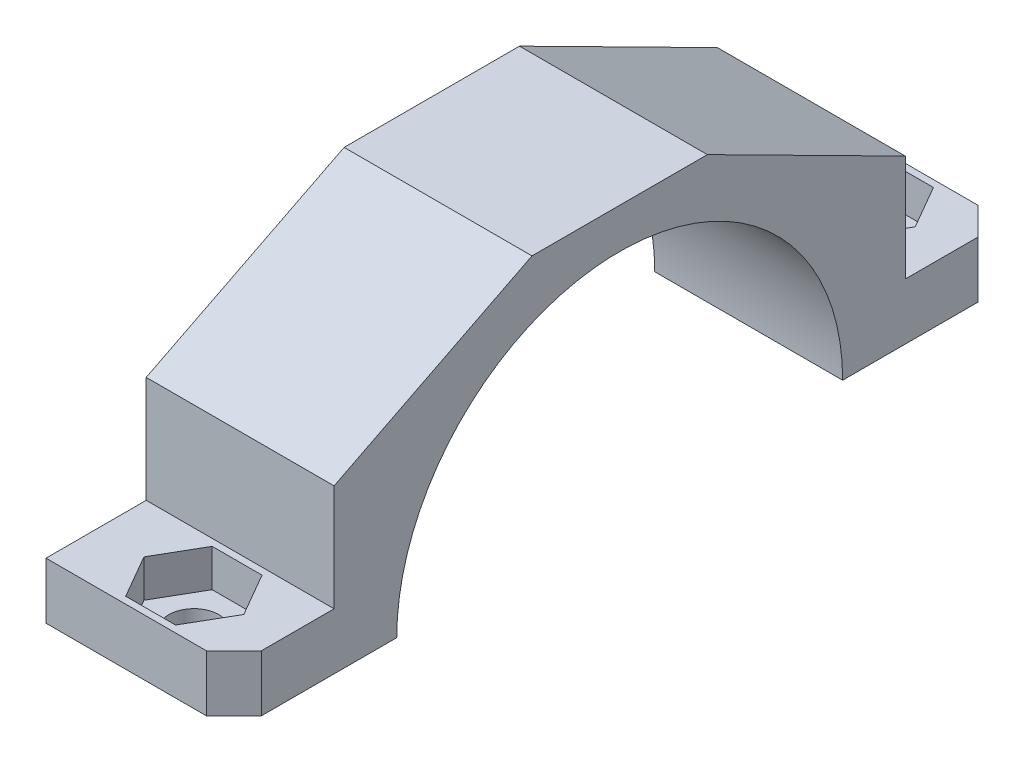
from build123d import *

# Parameters (mm, degrees)
BOSS_EXTRUDE1_DEPTH           = 7.5
CUT_EXTRUDE1_DEPTH            = 39.024860289
CSK_FOR_M4_SFHCS1_D           = 4
CSK_FOR_M4_SFHCS1_DEPTH       = 25.5
CSK_FOR_M4_SFHCS1_CSINK_D     = 7.6
CSK_FOR_M4_SFHCS1_CSINK_ANGLE = 90
CSK_FOR_M4_SFHCS1_TIP         = 1.201721238
CUT_EXTRUDE2_DEPTH            = 3


with BuildPart() as part:
    # Sketch1 → Boss-Extrude1 (new, symmetric)
    with BuildSketch(Plane(origin=(0, 0, 0), x_dir=(0, 0, -1), z_dir=(1, 0, 0))):
        with BuildLine():
            Line((-22.8, 4.5), (-22.8, 13))
            Line((-22.8, 13), (-7, 21))
            Line((-7, 21), (7, 21))
            Line((7, 21), (22.8, 13))
            Line((22.8, 13), (22.8, 4.5))
            Line((22.8, 4.5), (30.8, 4.5))
            Line((30.8, 4.5), (30.8, 0))
            Line((30.8, 0), (17.8, 0))
            ThreePointArc((17.8, 0), (0, 17.8), (-17.8, 0))
            Line((-17.8, 0), (-30.8, 0))
            Line((-30.8, 0), (-30.8, 4.5))
            Line((-30.8, 4.5), (-22.8, 4.5))
        make_face()
    extrude(amount=BOSS_EXTRUDE1_DEPTH, both=True)

    # Sketch2 → Cut-Extrude1 (cut, through all)
    with BuildSketch(Plane.XZ):
        Polygon((5.305249497, -30.8), (7.5, -28.605249497), (7.5, -30.8), align=None)
        Polygon((5.305249497, 30.8), (7.5, 28.605249497), (7.5, 30.8), align=None)
    extrude(amount=-CUT_EXTRUDE1_DEPTH, mode=Mode.SUBTRACT)

    # CSK for M4 SFHCS1
    with Locations(Plane(origin=(-1355.265966012, -21, 695.683007616), x_dir=(0, 0, -1), z_dir=(0, -1, 0))):
        with Locations((668.883007616, 1355.571215509), (668.883007616, 1318.571215509), (722.483007616, 1318.571215509), (722.483007616, 1355.571215509)):
            CounterSinkHole(CSK_FOR_M4_SFHCS1_D / 2, CSK_FOR_M4_SFHCS1_CSINK_D / 2, depth=CSK_FOR_M4_SFHCS1_DEPTH, counter_sink_angle=CSK_FOR_M4_SFHCS1_CSINK_ANGLE)
            with Locations((0, 0, -(CSK_FOR_M4_SFHCS1_DEPTH + CSK_FOR_M4_SFHCS1_TIP / 2))):  # 118° drill point
                Cone(0, CSK_FOR_M4_SFHCS1_D / 2, CSK_FOR_M4_SFHCS1_TIP, mode=Mode.SUBTRACT)

    # Sketch5 → Cut-Extrude2 (cut)
    with BuildSketch(Plane(origin=(0, 4.5, 0), x_dir=(1, 0, 0), z_dir=(0, 1, 0))):
        Polygon((-3.67846736, -26.8), (-1.686608932, -30.25), (2.297107926, -30.25), (4.288966355, -26.8), (2.297107926, -23.35), (-1.686608932, -23.35), align=None)
        Polygon((-3.67846736, 26.8), (-1.686608932, 23.35), (2.297107926, 23.35), (4.288966355, 26.8), (2.297107926, 30.25), (-1.686608932, 30.25), align=None)
    extrude(amount=-CUT_EXTRUDE2_DEPTH, mode=Mode.SUBTRACT)


solid = part.part
